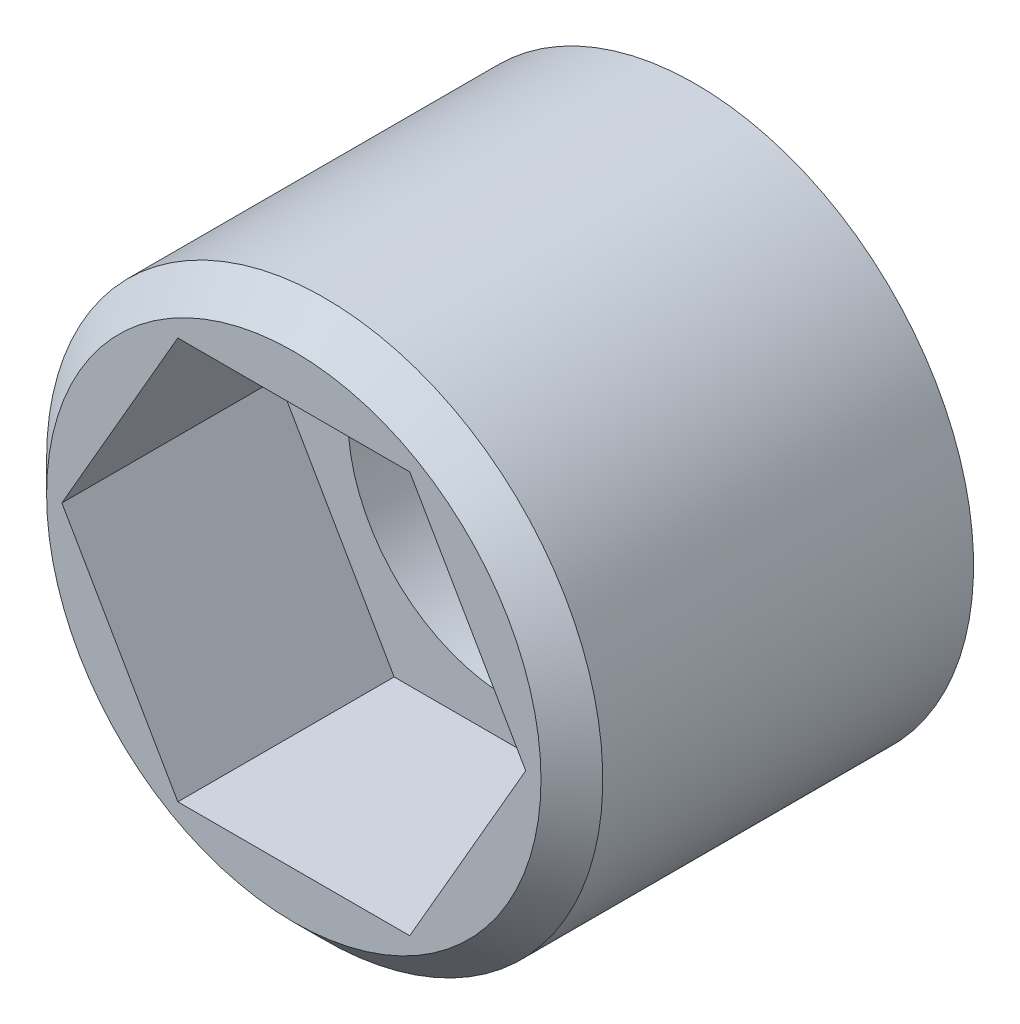
from build123d import *

# Parameters (mm, degrees)
ESQUISSE1_R             = 9
ESQUISSE1_R_2           = 5.25
BOSS_EXTRU_1_DEPTH      = 13
ENL_V_MAT_EXTRU_1_DEPTH = 7
CHANFREIN1_SIZE         = 1


with BuildPart() as part:
    # Esquisse1 → Boss.-Extru.1 (new body)
    with BuildSketch(Plane.XY):
        with Locations(Location((0, 0, 0), (0, 0, 180))):
            Circle(ESQUISSE1_R)
        with Locations(Location((0, 0, 0), (0, 0, 180))):
            Circle(ESQUISSE1_R_2, mode=Mode.SUBTRACT)
    extrude(amount=BOSS_EXTRU_1_DEPTH)

    # Esquisse2 → Enlèv. mat.-Extru.1 (cut)
    with BuildSketch(Plane.XY.offset(13)):
        Polygon((3.75277675, 6.5), (-3.75277675, 6.5), (-7.505553499, 0), (-3.75277675, -6.5), (3.75277675, -6.5), (7.505553499, 0), align=None)
    extrude(amount=-ENL_V_MAT_EXTRU_1_DEPTH, mode=Mode.SUBTRACT)

    # Chanfrein1
    chanfrein1_edges = [part.edges().sort_by_distance(p)[0] for p in [
        (9, 0, 13),
    ]]
    chamfer(chanfrein1_edges, length=CHANFREIN1_SIZE)


solid = part.part
